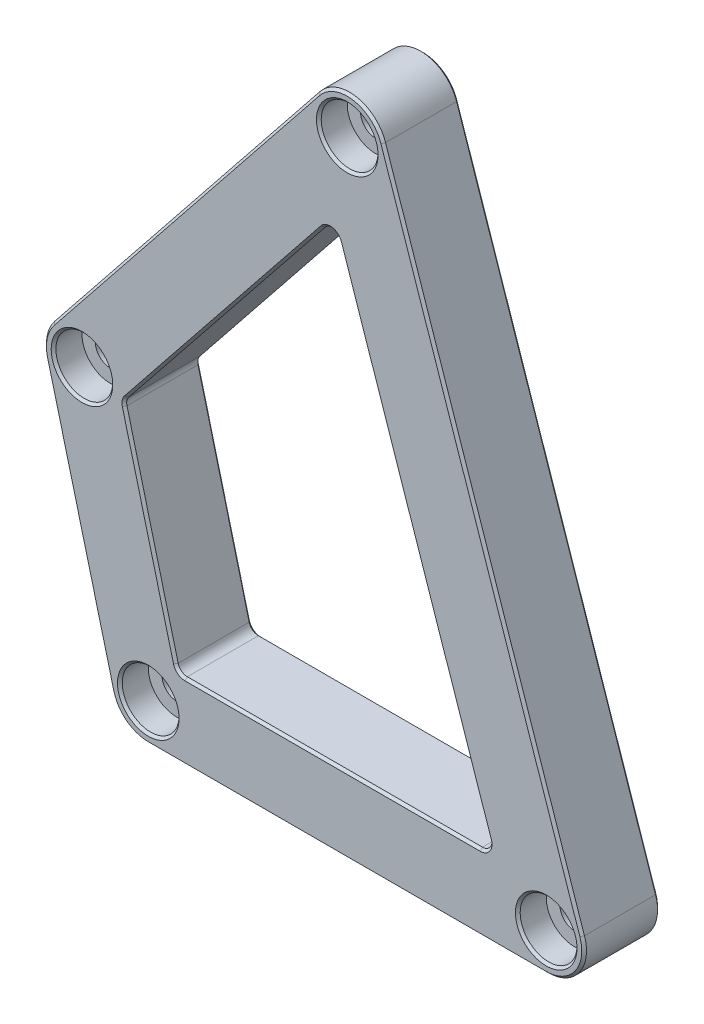
from build123d import *

# Parameters (mm, degrees)
SZKIC1_R                    = 1.55
SZKIC1_R_2                  = 1.6
DODANIE_WYCI_GNI_CIE1_DEPTH = 8
ZAOKR_GLENIE1_R             = 4
SZKIC2_R                    = 3
WYTNIJ_WYCI_GNI_CIE1_DEPTH  = 3
ZAOKR_GLENIE2_R             = 1
SFAZOWANIE1_SIZE            = 0.25
WYTNIJ_WYCI_GNI_CIE2_DEPTH  = 1


with BuildPart() as part:
    # Szkic1 → Dodanie-wyciągnięcie1 (new body)
    with BuildSketch(Plane.XY):
        Polygon((-32.374614688, -34.065144123), (1.443331859, 8.207289062), (26.5780588, -66), (-24.095207609, -66), align=None)
        with Locations((-21, -62)):
            Circle(SZKIC1_R, mode=Mode.SUBTRACT)
        with Locations((21, -62)):
            Circle(SZKIC1_R, mode=Mode.SUBTRACT)
        Circle(SZKIC1_R_2, mode=Mode.SUBTRACT)
        with Locations((-28, -35)):
            Circle(SZKIC1_R_2, mode=Mode.SUBTRACT)
        Polygon((-23.625385312, -35.934855877), (-1.443331859, -8.207289062), (15.4219412, -58), (-17.904792391, -58), align=None, mode=Mode.SUBTRACT)
    extrude(amount=DODANIE_WYCI_GNI_CIE1_DEPTH)

    # Zaokrąglenie1
    zaokr_glenie1_edges = [part.edges().sort_by_distance(p)[0] for p in [
        (-32.374614688, -34.065144123, 4),
        (1.443331859, 8.207289062, 4),
        (26.5780588, -66, 4),
        (-24.095207609, -66, 4),
    ]]
    fillet(zaokr_glenie1_edges, radius=ZAOKR_GLENIE1_R)

    # Szkic2 → Wytnij-wyciągnięcie1 (cut)
    with BuildSketch(Plane.XY.offset(8)):
        Circle(SZKIC2_R)
        with Locations((-28, -35)):
            Circle(SZKIC2_R)
        with Locations((-21, -62)):
            Circle(SZKIC2_R)
        with Locations((21, -62)):
            Circle(SZKIC2_R)
    extrude(amount=-WYTNIJ_WYCI_GNI_CIE1_DEPTH, mode=Mode.SUBTRACT)

    # Zaokrąglenie2
    zaokr_glenie2_edges = [part.edges().sort_by_distance(p)[0] for p in [
        (-23.625385312, -35.934855877, 4),
        (-17.904792391, -58, 4),
        (15.4219412, -58, 4),
        (-1.443331859, -8.207289062, 4),
    ]]
    fillet(zaokr_glenie2_edges, radius=ZAOKR_GLENIE2_R)

    # Sfazowanie1
    sfazowanie1_edges = [part.edges().sort_by_distance(p)[0] for p in [
        (7.058775414, -33.30874863, 0),
        (7.058775414, -33.30874863, 8),
        (-20.799357962, -46.835247082, 0),
        (-20.799357962, -46.835247082, 8),
        (-12.948817041, -22.589145539, 0),
        (-12.948817041, -22.589145539, 8),
        (14.84007865, -57.582749074, 0),
        (14.84007865, -57.582749074, 8),
        (-17.742969998, -57.790873618, 0),
        (-17.742969998, -57.790873618, 8),
        (-23.509651218, -35.959588272, 0),
        (-23.509651218, -35.959588272, 8),
        (-1.630962951, -9.274224983, 0),
        (-1.630962951, -9.274224983, 8),
        (0, -66, 0),
        (0, -66, 8),
        (-28.371987593, -49.503848635, 0),
        (-17.123475238, -15.00121981, 0),
        (14.288578303, -29.716771865, 0),
        (0.692807492, 3.939545377, 0),
        (24.2506086, -64.330996296, 0),
        (-31.911678313, -34.164073702, 0),
        (-23.44791804, -65.163494471, 0),
        (-28.371987593, -49.503848635, 8),
        (14.288578303, -29.716771865, 8),
        (-17.123475238, -15.00121981, 8),
        (0.692807492, 3.939545377, 8),
        (24.2506086, -64.330996296, 8),
        (-31.911678313, -34.164073702, 8),
        (-23.44791804, -65.163494471, 8),
        (-3, 0, 8),
        (-31, -35, 8),
        (-24, -62, 8),
        (18, -62, 8),
        (-1.551781994, -58, 0),
        (-1.551781994, -58, 8),
    ]]
    chamfer(sfazowanie1_edges, length=SFAZOWANIE1_SIZE)

    # Szkic3 → Wytnij-wyciągnięcie2 (cut)
    with BuildSketch(Plane(origin=(0, 0, 0), x_dir=(-1, 0, 0), z_dir=(0, 0, -1))):
        Polygon((-11, -60.5), (-11, -63.5), (-7.291900756, -62), align=None)
    extrude(amount=-WYTNIJ_WYCI_GNI_CIE2_DEPTH, mode=Mode.SUBTRACT)


solid = part.part
